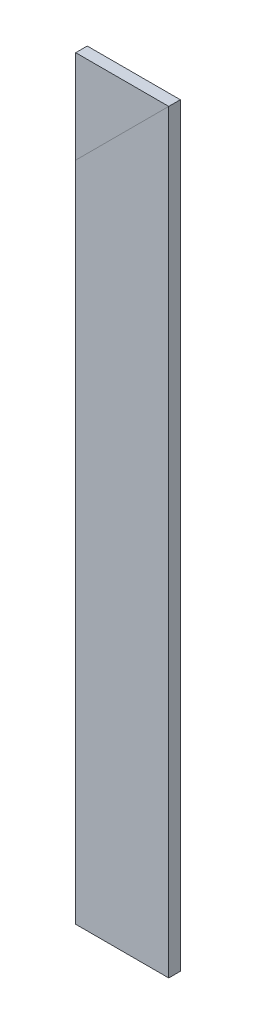
from build123d import *

# Parameters (mm, degrees)
CROQUIS2_W              = 6.31
CROQUIS2_H              = 50.8
CROQUIS3_W              = 174.155
CROQUIS3_H              = 6.31
CORTAR_EXTRUIR1_DEPTH   = 70
CROQUIS4_W              = 6.31
CROQUIS4_H              = 50.8
SALIENTE_EXTRUIR1_DEPTH = 40
CROQUIS5_R              = 6.35
CORTAR_EXTRUIR2_DEPTH   = 10
CROQUIS6_W              = 50.8
CROQUIS6_H              = 6.31
SALIENTE_EXTRUIR2_DEPTH = 50.8
CROQUIS7_W              = 40
CROQUIS7_H              = 50.8
CORTAR_EXTRUIR3_DEPTH   = 10
CROQUIS9_W              = 337.555
CROQUIS9_H              = 50.8
CORTAR_EXTRUIR4_DEPTH   = 67


with BuildPart() as part:
    # Barrer1: sweep along a curve in space
    with BuildLine() as barrer1_path:
        Line((0, 0, 0), (171, 0, 0))
        Line((171, 0, 0), (171, 0, -60))
        Line((171, 0, -60), (480, 0, -60))
        Line((480, 0, -60), (480, -386.69, -60))
    # Croquis2 → Barrer1 (sweep)
    with BuildSketch(Plane(origin=(0, 0, 0), x_dir=(0, 0, -1), z_dir=(1, 0, 0))):
        Rectangle(CROQUIS2_W, CROQUIS2_H)
    sweep(path=barrer1_path.line, transition=Transition.RIGHT)

    # Croquis3 → Cortar-Extruir1 (cut)
    with BuildSketch(Plane.XZ.offset(25.4)):
        with Locations((87.0775, 0)):
            Rectangle(CROQUIS3_W, CROQUIS3_H)
    extrude(amount=-CORTAR_EXTRUIR1_DEPTH, mode=Mode.SUBTRACT)

    # Croquis4 → Saliente-Extruir1 (add)
    with BuildSketch(Plane.XY.offset(-56.845)):
        with Locations((457.755, -361.29)):
            Rectangle(CROQUIS4_W, CROQUIS4_H)
    extrude(amount=SALIENTE_EXTRUIR1_DEPTH)

    # Croquis5 → Cortar-Extruir2 (cut)
    with BuildSketch(Plane(origin=(460.91, 0, 0), x_dir=(0, 0, -1), z_dir=(1, 0, 0))):
        with Locations((34.155, -346.6)):
            Circle(CROQUIS5_R)
        with Locations((34.155, -378.6)):
            Circle(CROQUIS5_R)
    extrude(amount=-CORTAR_EXTRUIR2_DEPTH, mode=Mode.SUBTRACT)

    # Croquis6 → Saliente-Extruir2 (add)
    with BuildSketch(Plane.ZY.offset(-167.845)):
        with Locations((-28.555, 22.245)):
            Rectangle(CROQUIS6_W, CROQUIS6_H)
    extrude(amount=SALIENTE_EXTRUIR2_DEPTH)

    # Croquis7 → Cortar-Extruir3 (cut)
    with BuildSketch(Plane(origin=(460.91, 0, 0), x_dir=(0, 0, -1), z_dir=(1, 0, 0))):
        with Locations((36.845, -361.29)):
            Rectangle(CROQUIS7_W, CROQUIS7_H)
    extrude(amount=-CORTAR_EXTRUIR3_DEPTH, mode=Mode.SUBTRACT)

    # Croquis9 → Cortar-Extruir4 (cut)
    with BuildSketch(Plane(origin=(0, 0, -63.155), x_dir=(-1, 0, 0), z_dir=(0, 0, -1))):
        with Locations((-285.8225, 0)):
            Rectangle(CROQUIS9_W, CROQUIS9_H)
    extrude(amount=-CORTAR_EXTRUIR4_DEPTH, mode=Mode.SUBTRACT)


solid = part.part
